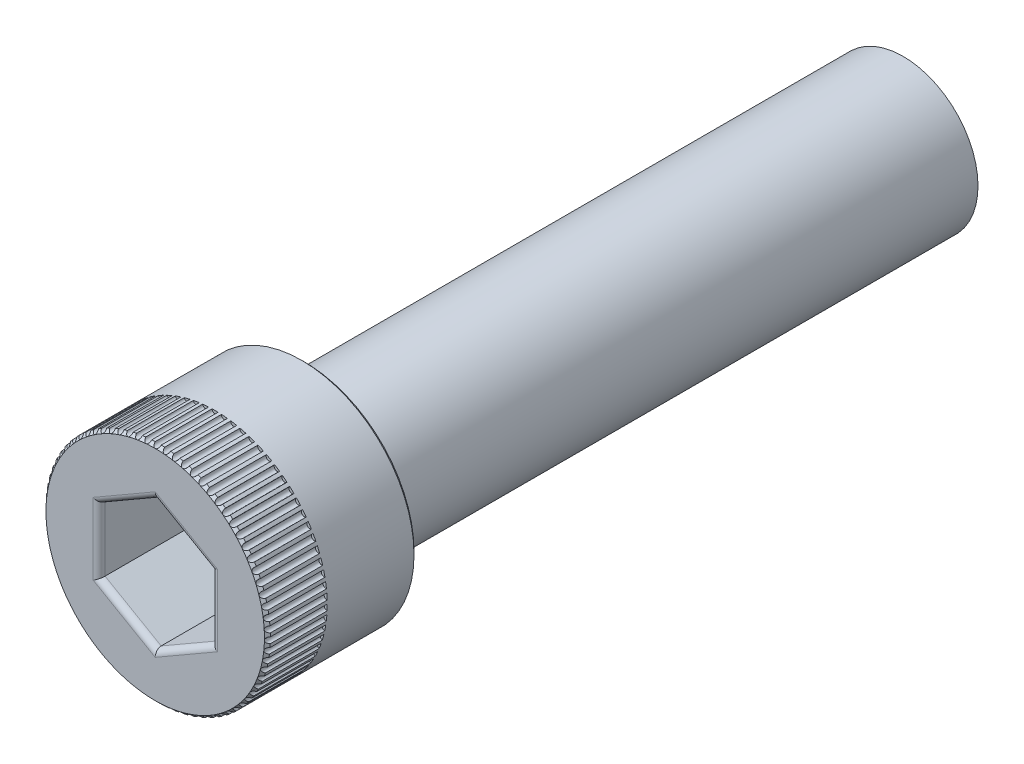
from build123d import *

# Parameters (mm, degrees)
SKETCH1_R          = 3.175
EXTRUDE1_DEPTH     = 25.4
SKETCH2_R          = 4.7625
EXTRUDE2_DEPTH     = 6.35
CHAMFER1_SIZE      = 0.127
CUT_EXTRUDE1_DEPTH = 3.81
FILLET1_R          = 0.254
SKETCH4_R          = 0.127
CUT_EXTRUDE2_DEPTH = 2.54
CIRPATTERN1_COUNT  = 75


with BuildPart() as part:
    # Sketch1 → Extrude1 (new body)
    with BuildSketch(Plane.XY):
        Circle(SKETCH1_R)
    extrude(amount=EXTRUDE1_DEPTH)

    # Sketch2 → Extrude2 (add)
    with BuildSketch(Plane.XY.offset(25.4)):
        Circle(SKETCH2_R)
    extrude(amount=EXTRUDE2_DEPTH)

    # Chamfer1
    chamfer1_edges = [part.edges().sort_by_distance(p)[0] for p in [
        (-4.7625, 0, 25.4),
        (-4.7625, 0, 31.75),
    ]]
    chamfer(chamfer1_edges, length=CHAMFER1_SIZE)

    # Sketch3 → Cut-Extrude1 (cut)
    with BuildSketch(Plane.XY.offset(31.75)):
        Polygon((0, 2.749630657), (-2.38125, 1.374815329), (-2.38125, -1.374815329), (0, -2.749630657), (2.38125, -1.374815329), (2.38125, 1.374815329), align=None)
    extrude(amount=-CUT_EXTRUDE1_DEPTH, mode=Mode.SUBTRACT)

    # Fillet1
    fillet1_edges = [part.edges().sort_by_distance(p)[0] for p in [
        (1.190625, 2.062222993, 31.75),
        (-1.190625, 2.062222993, 31.75),
        (-2.38125, 0, 31.75),
        (-1.190625, -2.062222993, 31.75),
        (1.190625, -2.062222993, 31.75),
        (2.38125, 0, 31.75),
    ]]
    fillet(fillet1_edges, radius=FILLET1_R)

    # Sketch4 → Cut-Extrude2 (cut)
    with BuildSketch(Plane.XY.offset(31.75)):
        with Locations((0, 4.7625)):
            Circle(SKETCH4_R)
    cut_extrude2 = extrude(amount=-CUT_EXTRUDE2_DEPTH, mode=Mode.SUBTRACT)

    # CirPattern1: Cut-Extrude2 ×75 about axis
    cirpattern1_axis = Axis((0, 0, 0), (0, 0, 1))
    for i in range(1, CIRPATTERN1_COUNT):
        add(cut_extrude2.rotate(cirpattern1_axis, i * 360 / CIRPATTERN1_COUNT), mode=Mode.SUBTRACT)


solid = part.part
